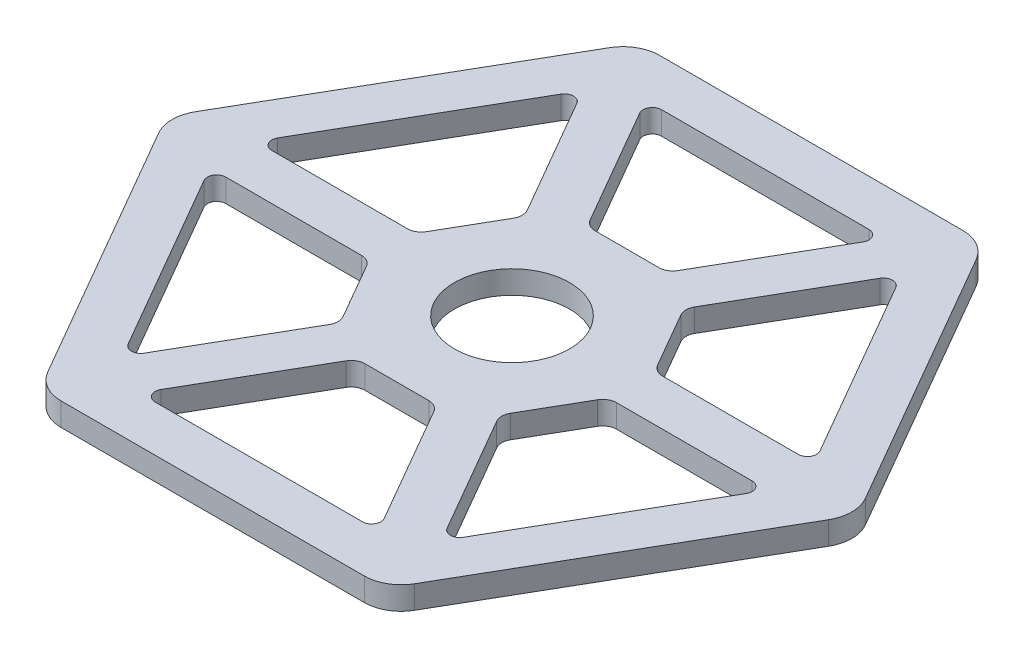
from build123d import *

# Parameters (mm, degrees)
BOSS_EXTRUDE1_DEPTH = 5
FILLET1_R           = 8
SKETCH2_R           = 12.5
CUT_EXTRUDE1_DEPTH  = 10


with BuildPart() as part:
    # Sketch1 → Boss-Extrude1 (new body)
    with BuildSketch(Plane(origin=(0, 0, 0), x_dir=(1, 0, 0), z_dir=(0, 1, 0))):
        Polygon((-75.055534995, 0), (-37.527767497, -65), (37.527767497, -65), (75.055534995, 0), (37.527767497, 65), (-37.527767497, 65), align=None)
    extrude(amount=BOSS_EXTRUDE1_DEPTH)

    # Fillet1
    fillet1_edges = [part.edges().sort_by_distance(p)[0] for p in [
        (-37.527767497, 2.5, -65),
        (37.527767497, 2.5, -65),
        (75.055534995, 2.5, 0),
        (37.527767497, 2.5, 65),
        (-37.527767497, 2.5, 65),
        (-75.055534995, 2.5, 0),
    ]]
    fillet(fillet1_edges, radius=FILLET1_R)

    # Sketch2 → Cut-Extrude1 (cut)
    with BuildSketch(Plane(origin=(0, 5, 0), x_dir=(1, 0, 0), z_dir=(0, 1, 0))):
        with Locations(Location((0, 0, 0), (0, 0, 270))):
            Circle(SKETCH2_R)
        with BuildLine():
            Line((9.526279442, 26.5), (24.248711306, 52))
            ThreePointArc((24.248711306, 52), (24.248711306, 54), (22.516660498, 55))
            Line((22.516660498, 55), (-22.516660498, 55))
            ThreePointArc((-22.516660498, 55), (-24.248711306, 54), (-24.248711306, 52))
            Line((-24.248711306, 52), (-9.526279442, 26.5))
            ThreePointArc((-9.526279442, 26.5), (-8.42820323, 25.401923789), (-6.92820323, 25))
            Line((-6.92820323, 25), (6.92820323, 25))
            ThreePointArc((6.92820323, 25), (8.42820323, 25.401923789), (9.526279442, 26.5))
        make_face()
        with BuildLine():
            Line((27.712812921, 5), (57.15767665, 5))
            ThreePointArc((57.15767665, 5), (58.889727457, 6), (58.889727457, 8))
            Line((58.889727457, 8), (36.373066959, 47))
            ThreePointArc((36.373066959, 47), (34.641016151, 48), (32.908965344, 47))
            Line((32.908965344, 47), (18.186533479, 21.5))
            ThreePointArc((18.186533479, 21.5), (17.784609691, 20), (18.186533479, 18.5))
            Line((18.186533479, 18.5), (25.11473671, 6.5))
            ThreePointArc((25.11473671, 6.5), (26.212812921, 5.401923789), (27.712812921, 5))
        make_face()
        with BuildLine():
            Line((18.186533479, -21.5), (32.908965344, -47))
            ThreePointArc((32.908965344, -47), (34.641016151, -48), (36.373066959, -47))
            Line((36.373066959, -47), (58.889727457, -8))
            ThreePointArc((58.889727457, -8), (58.889727457, -6), (57.15767665, -5))
            Line((57.15767665, -5), (27.712812921, -5))
            ThreePointArc((27.712812921, -5), (26.212812921, -5.401923789), (25.11473671, -6.5))
            Line((25.11473671, -6.5), (18.186533479, -18.5))
            ThreePointArc((18.186533479, -18.5), (17.784609691, -20), (18.186533479, -21.5))
        make_face()
        with BuildLine():
            Line((-9.526279442, -26.5), (-24.248711306, -52))
            ThreePointArc((-24.248711306, -52), (-24.248711306, -54), (-22.516660498, -55))
            Line((-22.516660498, -55), (22.516660498, -55))
            ThreePointArc((22.516660498, -55), (24.248711306, -54), (24.248711306, -52))
            Line((24.248711306, -52), (9.526279442, -26.5))
            ThreePointArc((9.526279442, -26.5), (8.42820323, -25.401923789), (6.92820323, -25))
            Line((6.92820323, -25), (-6.92820323, -25))
            ThreePointArc((-6.92820323, -25), (-8.42820323, -25.401923789), (-9.526279442, -26.5))
        make_face()
        with BuildLine():
            Line((-27.712812921, -5), (-57.15767665, -5))
            ThreePointArc((-57.15767665, -5), (-58.889727457, -6), (-58.889727457, -8))
            Line((-58.889727457, -8), (-36.373066959, -47))
            ThreePointArc((-36.373066959, -47), (-34.641016151, -48), (-32.908965344, -47))
            Line((-32.908965344, -47), (-18.186533479, -21.5))
            ThreePointArc((-18.186533479, -21.5), (-17.784609691, -20), (-18.186533479, -18.5))
            Line((-18.186533479, -18.5), (-25.11473671, -6.5))
            ThreePointArc((-25.11473671, -6.5), (-26.212812921, -5.401923789), (-27.712812921, -5))
        make_face()
        with BuildLine():
            Line((-18.186533479, 21.5), (-32.908965344, 47))
            ThreePointArc((-32.908965344, 47), (-34.641016151, 48), (-36.373066959, 47))
            Line((-36.373066959, 47), (-58.889727457, 8))
            ThreePointArc((-58.889727457, 8), (-58.889727457, 6), (-57.15767665, 5))
            Line((-57.15767665, 5), (-27.712812921, 5))
            ThreePointArc((-27.712812921, 5), (-26.212812921, 5.401923789), (-25.11473671, 6.5))
            Line((-25.11473671, 6.5), (-18.186533479, 18.5))
            ThreePointArc((-18.186533479, 18.5), (-17.784609691, 20), (-18.186533479, 21.5))
        make_face()
    extrude(amount=-CUT_EXTRUDE1_DEPTH, mode=Mode.SUBTRACT)


solid = part.part
